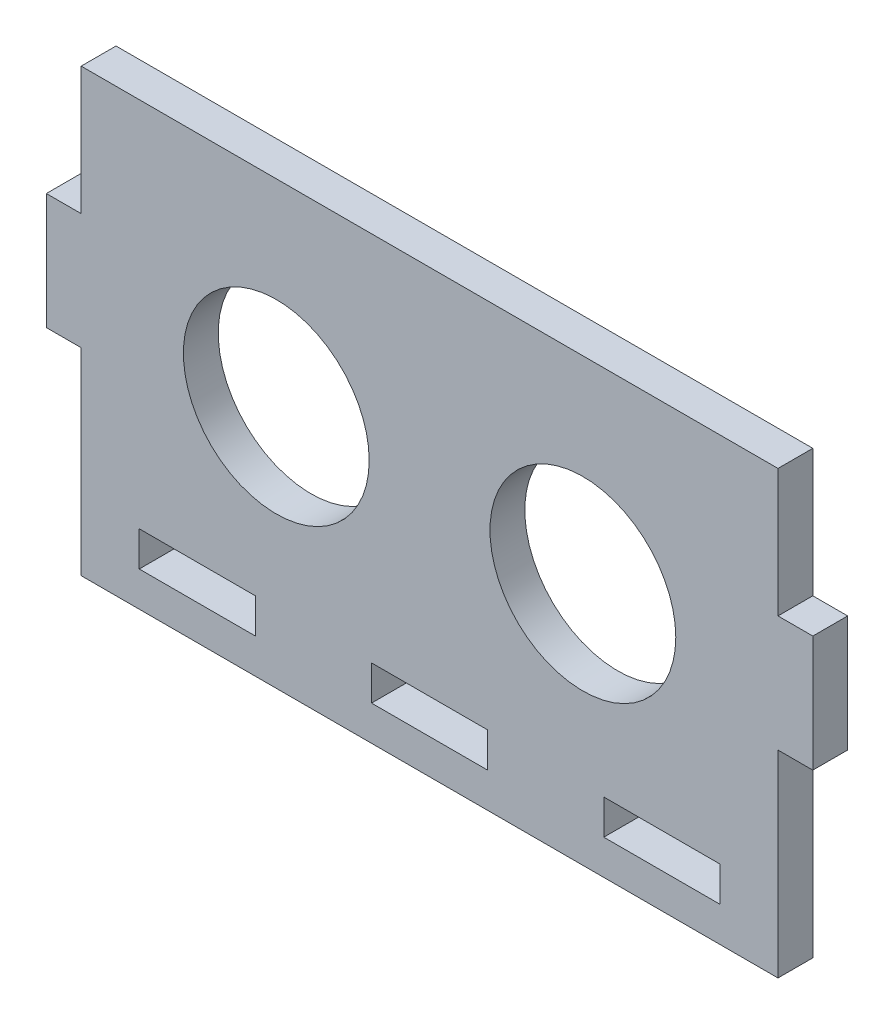
from build123d import *

# Parameters (mm, degrees)
SKETCH1_W           = 60
SKETCH1_H           = 38
SKETCH1_R           = 8
SKETCH1_W_2         = 10
SKETCH1_H_2         = 3
SKETCH1_W_3         = 3
SKETCH1_H_3         = 10
BOSS_EXTRUDE1_DEPTH = 3


with BuildPart() as part:
    # Sketch1 → Boss-Extrude1 (new body)
    # profile 1 of 3: a face of its own
    with BuildSketch(Plane.XY):
        with Locations((-2.850678733, -3.932126697)):
            Rectangle(SKETCH1_W, SKETCH1_H)
        with Locations((-16.050678733, -1.932126697)):
            Circle(SKETCH1_R, mode=Mode.SUBTRACT)
        with Locations((10.349321267, -1.932126697)):
            Circle(SKETCH1_R, mode=Mode.SUBTRACT)
        with Locations((-2.850678733, -18.432126697)):
            Rectangle(SKETCH1_W_2, SKETCH1_H_2, mode=Mode.SUBTRACT)
        with Locations((17.149321267, -18.432126697)):
            Rectangle(SKETCH1_W_2, SKETCH1_H_2, mode=Mode.SUBTRACT)
        with Locations((-22.850678733, -18.432126697)):
            Rectangle(SKETCH1_W_2, SKETCH1_H_2, mode=Mode.SUBTRACT)
    # profile 2 of 3: a face of its own
    with BuildSketch(Plane.XY):
        with Locations((-34.350678733, -0.932126697)):
            Rectangle(SKETCH1_W_3, SKETCH1_H_3)
    # profile 3 of 3: a face of its own
    with BuildSketch(Plane.XY):
        with Locations((28.649321267, -0.932126697)):
            Rectangle(SKETCH1_W_3, SKETCH1_H_3)
    extrude(amount=BOSS_EXTRUDE1_DEPTH)


solid = part.part
